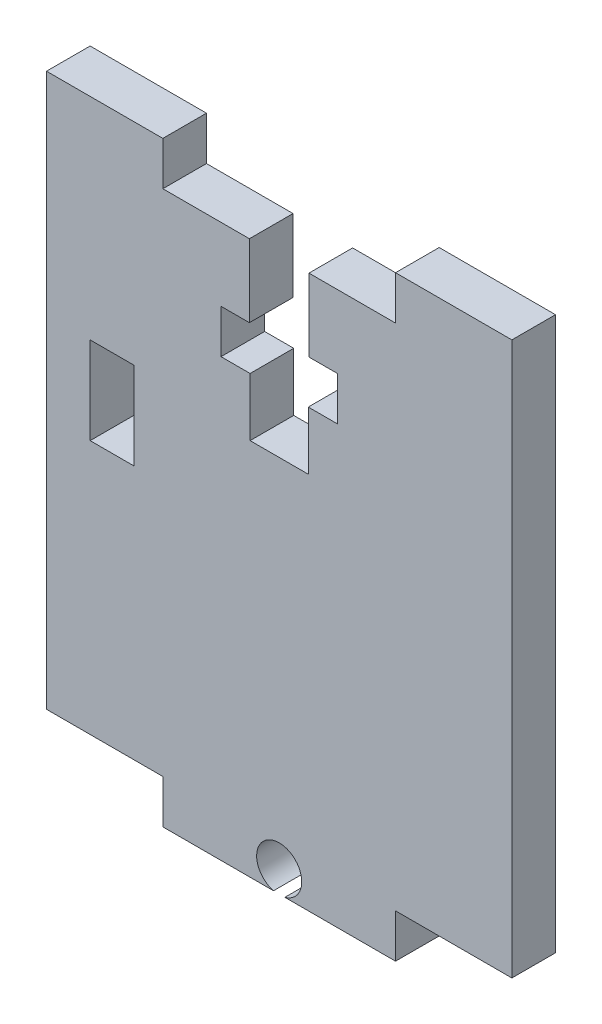
from build123d import *

# Parameters (mm, degrees)
SKETCH_2_W      = 3
SKETCH_2_H      = 6
EXTRUDE_1_DEPTH = 3


with BuildPart() as part:
    # 草图2 → 凸台-拉伸1 (new body)
    with BuildSketch(Plane.XY):
        with BuildLine():
            Line((2.047890023, 48.855305477), (8, 48.855305477))
            Line((8, 48.855305477), (8, 51.855305477))
            Line((8, 51.855305477), (16, 51.855305477))
            Line((16, 51.855305477), (16, 13.855305477))
            Line((16, 13.855305477), (8, 13.855305477))
            Line((8, 13.855305477), (8, 10.855305477))
            Line((8, 10.855305477), (0.390512484, 10.855305477))
            ThreePointArc((0.390512484, 10.855305477), (0, 13.905305477), (-0.390512484, 10.855305477))
            Line((-0.390512484, 10.855305477), (-8, 10.855305477))
            Line((-8, 10.855305477), (-8, 13.855305477))
            Line((-8, 13.855305477), (-16, 13.855305477))
            Line((-16, 13.855305477), (-16, 51.855305477))
            Line((-16, 51.855305477), (-8, 51.855305477))
            Line((-8, 51.855305477), (-8, 48.855305477))
            Line((-8, 48.855305477), (-2.047890023, 48.855305477))
            Line((-2.047890023, 48.855305477), (-2.047890023, 43.855305477))
            Line((-2.047890023, 43.855305477), (-4, 43.855305477))
            Line((-4, 43.855305477), (-4, 40.855305477))
            Line((-4, 40.855305477), (-2, 40.855305477))
            Line((-2, 40.855305477), (-2, 36.855305477))
            Line((-2, 36.855305477), (2, 36.855305477))
            Line((2, 36.855305477), (2, 40.855305477))
            Line((2, 40.855305477), (4, 40.855305477))
            Line((4, 40.855305477), (4, 43.855305477))
            Line((4, 43.855305477), (2.047890023, 43.855305477))
            Line((2.047890023, 43.855305477), (2.047890023, 48.855305477))
        make_face()
        with Locations((-11.5, 34.355305477)):
            Rectangle(SKETCH_2_W, SKETCH_2_H, mode=Mode.SUBTRACT)
    extrude(amount=EXTRUDE_1_DEPTH)


solid = part.part
